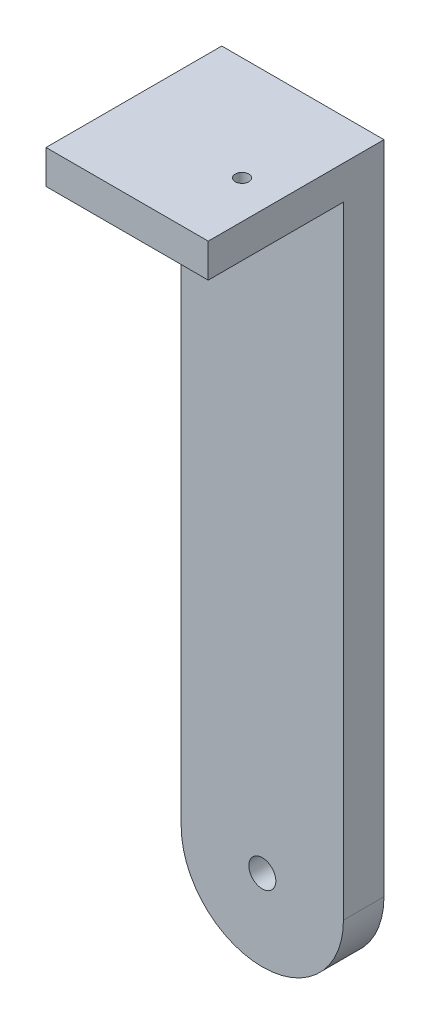
from build123d import *

# Parameters (mm, degrees)
SKETCH1_R                = 10
BOSS_EXTRUDE1_DEPTH      = 30
BOSS_EXTRUDE2_DEPTH      = 100
BOSS_EXTRUDE2_DEPTH_BACK = 30
SKETCH2_W                = 120
SKETCH2_H                = 25
SKETCH3_R                = 5
CUT_EXTRUDE1_DEPTH       = 70


with BuildPart() as part:
    # Sketch1 → Boss-Extrude1 (new body)
    with BuildSketch(Plane(origin=(0, 0, 0), x_dir=(0, 1, 0), z_dir=(0, 0, 1))):
        with BuildLine():
            Line((0, 60), (400, 60))
            Line((400, 60), (460, 60))
            Line((460, 60), (460, -60))
            Line((460, -60), (400, -60))
            Line((400, -60), (0, -60))
            ThreePointArc((0, -60), (-60, 0), (0, 60))
        make_face()
        with Locations(Location((0, 0, 0), (0, 0, 270))):
            Circle(SKETCH1_R, mode=Mode.SUBTRACT)
    extrude(amount=BOSS_EXTRUDE1_DEPTH)

    # Sketch2 → Boss-Extrude2 (add, two sides: drawn at the far end of the back side and taken through both)
    with BuildSketch(Plane.XY.offset(30).offset(-BOSS_EXTRUDE2_DEPTH_BACK)):
        with Locations((0, 472.5)):
            Rectangle(SKETCH2_W, SKETCH2_H)
    extrude(amount=BOSS_EXTRUDE2_DEPTH + BOSS_EXTRUDE2_DEPTH_BACK)

    # Sketch3 → Cut-Extrude1 (cut)
    with BuildSketch(Plane.XZ.offset(-460)):
        with Locations(Location((32, 77, 0), (0, 0, 270))):
            Circle(SKETCH3_R)
    extrude(amount=-CUT_EXTRUDE1_DEPTH, mode=Mode.SUBTRACT)


solid = part.part
